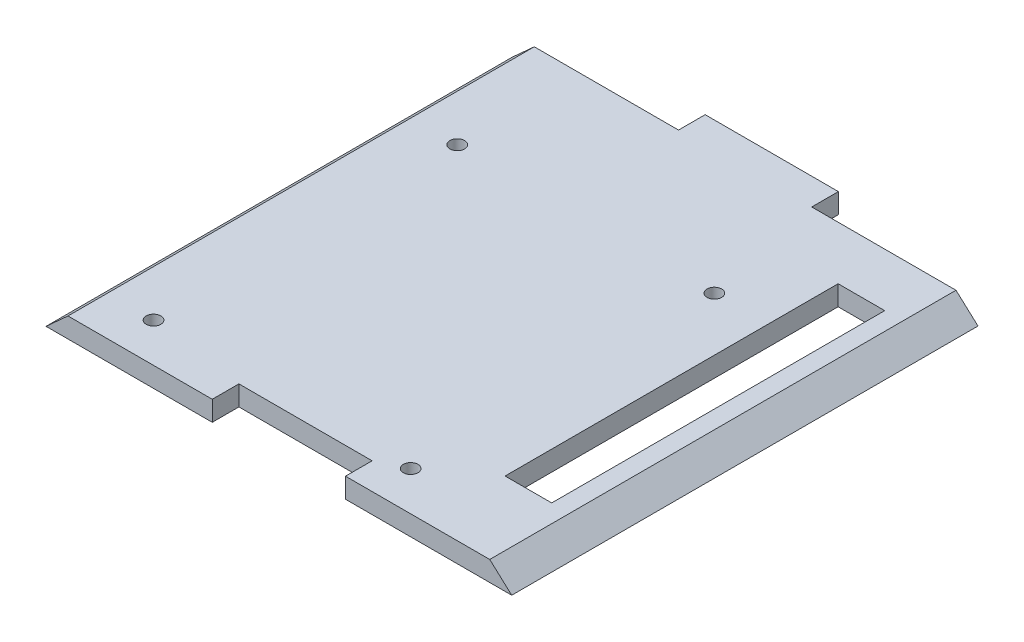
from build123d import *

# Parameters (mm, degrees)
BOSS_EXTRUDE1_DEPTH = 88.9
SKETCH2_R           = 1.397
CUT_EXTRUDE1_DEPTH  = 100.443456884
SKETCH3_W           = 25.4
SKETCH3_H           = 5.08
CUT_EXTRUDE2_DEPTH  = 100.443456884
SKETCH5_W           = 25.4
SKETCH5_H           = 10.16
BOSS_EXTRUDE3_DEPTH = 3.81
SKETCH6_W           = 8.89
SKETCH6_H           = 63.5
CUT_EXTRUDE3_DEPTH  = 100.443456884


with BuildPart() as part:
    # Sketch1 → Boss-Extrude1 (new body)
    with BuildSketch(Plane.XY):
        Polygon((-40.203883769, 5.937788296), (40.203883769, 5.937788296), (44.399042974, 2.127788296), (-44.399042974, 2.127788296), align=None)
    extrude(amount=BOSS_EXTRUDE1_DEPTH)

    # Sketch2 → Cut-Extrude1 (cut, through all)
    with BuildSketch(Plane.XZ.offset(-2.127788296)):
        with Locations(Location((-31.369, 81.429995649, 0), (0, 0, 270))):
            Circle(SKETCH2_R)
        with Locations(Location((17.653, 23.517995649, 0), (0, 0, 270))):
            Circle(SKETCH2_R)
        with Locations(Location((-31.369, 23.517995649, 0), (0, 0, 270))):
            Circle(SKETCH2_R)
        with Locations(Location((17.653, 81.429995649, 0), (0, 0, 270))):
            Circle(SKETCH2_R)
    extrude(amount=-CUT_EXTRUDE1_DEPTH, mode=Mode.SUBTRACT)

    # Sketch3 → Cut-Extrude2 (cut, through all)
    with BuildSketch(Plane.XZ.offset(-2.127788296)):
        with Locations((0, 86.36)):
            Rectangle(SKETCH3_W, SKETCH3_H)
        with Locations((0, 2.54)):
            Rectangle(SKETCH3_W, SKETCH3_H)
    extrude(amount=-CUT_EXTRUDE2_DEPTH, mode=Mode.SUBTRACT)

    # Sketch5 → Boss-Extrude3 (add)
    with BuildSketch(Plane.XZ.offset(-2.127788296)):
        Rectangle(SKETCH5_W, SKETCH5_H)
    extrude(amount=-BOSS_EXTRUDE3_DEPTH)

    # Sketch6 → Cut-Extrude3 (cut, through all)
    with BuildSketch(Plane.XZ.offset(-2.127788296)):
        with Locations((32.334042974, 41.91)):
            Rectangle(SKETCH6_W, SKETCH6_H)
    extrude(amount=-CUT_EXTRUDE3_DEPTH, mode=Mode.SUBTRACT)


solid = part.part
